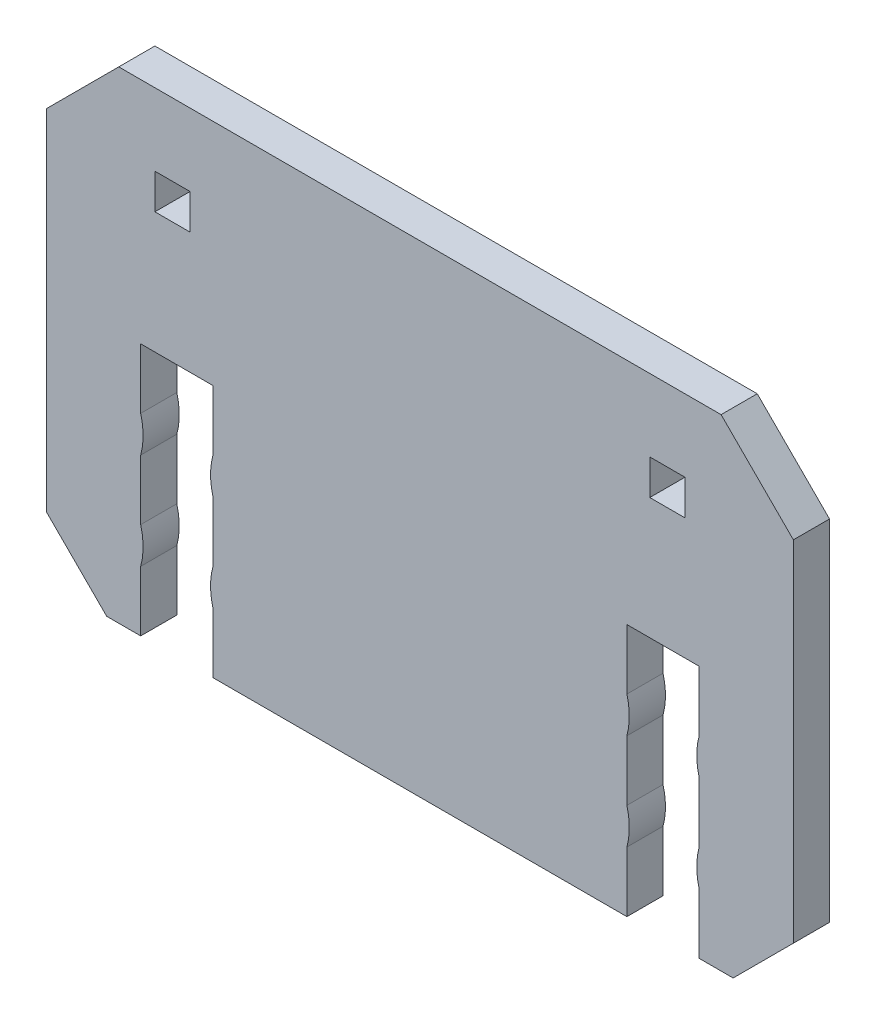
from build123d import *

# Parameters (mm, degrees)
SKETCH1_W           = 2.92
SKETCH1_H           = 2.92
BOSS_EXTRUDE1_DEPTH = 3


with BuildPart() as part:
    # Sketch1 → Boss-Extrude1 (new body)
    with BuildSketch(Plane.XY):
        with BuildLine():
            Line((28.134570185, 8.537968033), (22.134570185, 14.537968033))
            Line((22.134570185, 14.537968033), (-27.865429815, 14.537968033))
            Line((-27.865429815, 14.537968033), (-33.865429815, 8.537968033))
            Line((-33.865429815, 8.537968033), (-33.865429815, -20.462031967))
            Line((-33.865429815, -20.462031967), (-28.865429815, -25.462031967))
            Line((-28.865429815, -25.462031967), (-26.045429815, -25.462031967))
            Line((-26.045429815, -25.462031967), (-26.045429815, -20.462031967))
            ThreePointArc((-26.045429815, -20.462031967), (-25.845429815, -18.962031967), (-26.045429815, -17.462031967))
            Line((-26.045429815, -17.462031967), (-26.045429815, -12.462031967))
            ThreePointArc((-26.045429815, -12.462031967), (-25.845429815, -10.962031967), (-26.045429815, -9.462031967))
            Line((-26.045429815, -9.462031967), (-26.045429815, -4.462031967))
            Line((-26.045429815, -4.462031967), (-20.045429815, -4.462031967))
            Line((-20.045429815, -4.462031967), (-20.045429815, -9.462031967))
            ThreePointArc((-20.045429815, -9.462031967), (-20.245429815, -10.962031967), (-20.045429815, -12.462031967))
            Line((-20.045429815, -12.462031967), (-20.045429815, -17.462031967))
            ThreePointArc((-20.045429815, -17.462031967), (-20.245429815, -18.962031967), (-20.045429815, -20.462031967))
            Line((-20.045429815, -20.462031967), (-20.045429815, -25.462031967))
            Line((-20.045429815, -25.462031967), (14.314570185, -25.462031967))
            Line((14.314570185, -25.462031967), (14.314570185, -20.462031967))
            ThreePointArc((14.314570185, -20.462031967), (14.514570185, -18.962031967), (14.314570185, -17.462031967))
            Line((14.314570185, -17.462031967), (14.314570185, -12.462031967))
            ThreePointArc((14.314570185, -12.462031967), (14.514570185, -10.962031967), (14.314570185, -9.462031967))
            Line((14.314570185, -9.462031967), (14.314570185, -4.462031967))
            Line((14.314570185, -4.462031967), (20.314570185, -4.462031967))
            Line((20.314570185, -4.462031967), (20.314570185, -9.462031967))
            ThreePointArc((20.314570185, -9.462031967), (20.164790454, -10.20539467), (20.114570185, -10.962031967))
            ThreePointArc((20.114570185, -10.962031967), (20.164790454, -11.718669265), (20.314570185, -12.462031967))
            Line((20.314570185, -12.462031967), (20.314570185, -17.462031967))
            ThreePointArc((20.314570185, -17.462031967), (20.164790454, -18.20539467), (20.114570185, -18.962031967))
            ThreePointArc((20.114570185, -18.962031967), (20.164790454, -19.718669265), (20.314570185, -20.462031967))
            Line((20.314570185, -20.462031967), (20.314570185, -25.462031967))
            Line((20.314570185, -25.462031967), (23.134570185, -25.462031967))
            Line((23.134570185, -25.462031967), (28.134570185, -20.462031967))
            Line((28.134570185, -20.462031967), (28.134570185, 8.537968033))
        make_face()
        with Locations((-23.405429815, 7.077968033)):
            Rectangle(SKETCH1_W, SKETCH1_H, mode=Mode.SUBTRACT)
        with Locations((17.674570185, 7.077968033)):
            Rectangle(SKETCH1_W, SKETCH1_H, mode=Mode.SUBTRACT)
    extrude(amount=BOSS_EXTRUDE1_DEPTH)


solid = part.part
